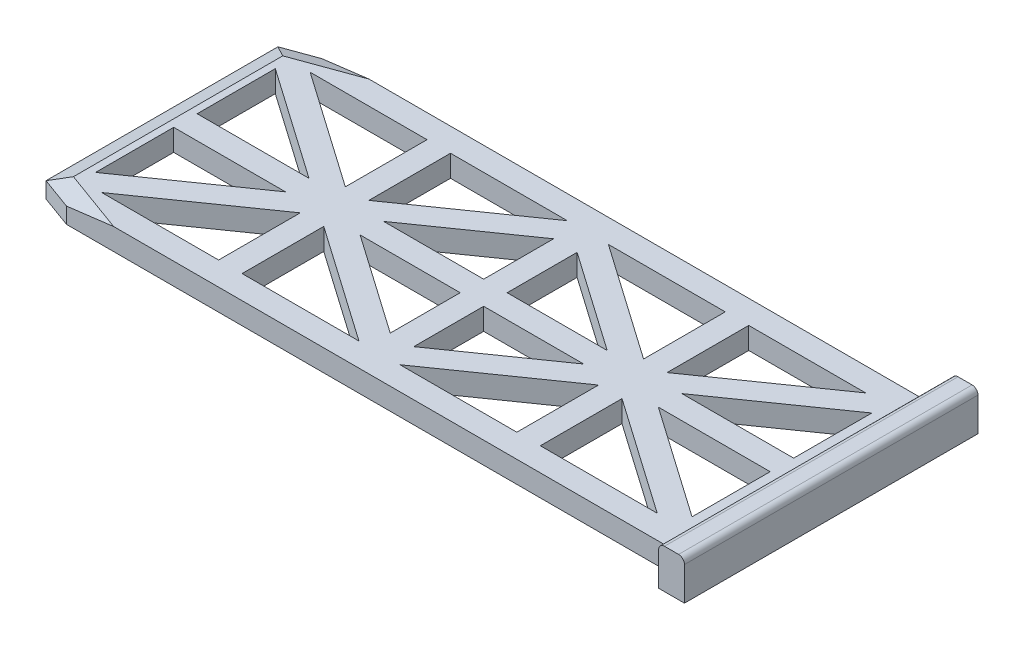
from build123d import *
from OCP.BRepFilletAPI import BRepFilletAPI_MakeChamfer

# Parameters (mm, degrees)
SKETCH1_W                = 114
SKETCH1_H                = 43.5
BOSS_EXTRUDE1_DEPTH      = 3.7
SKETCH2_W                = 4.4
SKETCH2_H                = 43.5
BOSS_EXTRUDE2_DEPTH      = 3
CHAMFER1_SIZE            = 2
CHAMFER1_SIZE2           = 5.494954839
CUT_EXTRUDE1_DEPTH       = 7.5
BOSS_EXTRUDE3_DEPTH      = 3.25
BOSS_EXTRUDE3_DEPTH_BACK = 46.75
SKETCH6_W                = 4.4
SKETCH6_H                = 6.7
FILLET2_R                = 1
CHAMFER2_SIZE            = 1
CHAMFER2_SIZE2           = 2.747477419


with BuildPart() as part:
    # Sketch1 → Boss-Extrude1 (new body)
    with BuildSketch(Plane(origin=(0, 0, 0), x_dir=(1, 0, 0), z_dir=(0, 1, 0))):
        with Locations((57, 21.75)):
            Rectangle(SKETCH1_W, SKETCH1_H)
    extrude(amount=BOSS_EXTRUDE1_DEPTH)

    # Sketch2 → Boss-Extrude2 (add)
    with BuildSketch(Plane(origin=(0, 3.7, 0), x_dir=(1, 0, 0), z_dir=(0, 1, 0))):
        with Locations((111.8, 21.75)):
            Rectangle(SKETCH2_W, SKETCH2_H)
    extrude(amount=BOSS_EXTRUDE2_DEPTH)

    # Chamfer1
    chamfer1_edges = [part.edges().sort_by_distance(p)[0] for p in [
        (0, 1.85, -43.5),
        (0, 1.85, 0),
    ]]
    chamfer1_side = [part.faces().sort_by_distance(p)[0] for p in [
        (0, 1.85, -21.75),
    ]]
    chamfer(chamfer1_edges, length=CHAMFER1_SIZE, length2=CHAMFER1_SIZE2, reference=chamfer1_side[0])

    # Sketch3 → Cut-Extrude1 (cut)
    with BuildSketch(Plane(origin=(0, 3.7, 0), x_dir=(1, 0, 0), z_dir=(0, 1, 0))):
        Polygon((4, 6.439957255), (23.046483703, 19.75), (4, 19.75), align=None)
        Polygon((27.4, 4), (27.4, 17.91240495), (7.491544466, 4), align=None)
        Polygon((23.046483703, 23.75), (4, 37.060042745), (4, 23.75), align=None)
        Polygon((27.4, 25.58759505), (27.4, 39.5), (7.491544466, 39.5), align=None)
        Polygon((31.4, 25.58759505), (51.308455534, 39.5), (31.4, 39.5), align=None)
        Polygon((52.8, 23.75), (52.8, 35.66240495), (35.753516297, 23.75), align=None)
        Polygon((52.8, 7.83759505), (52.8, 19.75), (35.753516297, 19.75), align=None)
        Polygon((31.4, 4), (51.308455534, 4), (31.4, 17.91240495), align=None)
        Polygon((73.846483703, 19.75), (56.8, 19.75), (56.8, 7.83759505), align=None)
        Polygon((78.2, 17.91240495), (58.291544466, 4), (78.2, 4), align=None)
        Polygon((56.8, 35.66240495), (56.8, 23.75), (73.846483703, 23.75), align=None)
        Polygon((78.2, 39.5), (58.291544466, 39.5), (78.2, 25.58759505), align=None)
        Polygon((102.108455534, 39.5), (82.2, 39.5), (82.2, 25.58759505), align=None)
        Polygon((105.6, 23.75), (105.6, 37.060042745), (86.553516297, 23.75), align=None)
        Polygon((105.6, 19.75), (86.553516297, 19.75), (105.6, 6.439957255), align=None)
        Polygon((82.2, 17.91240495), (82.2, 4), (102.108455534, 4), align=None)
    extrude(amount=-CUT_EXTRUDE1_DEPTH, mode=Mode.SUBTRACT)

    # Sketch6 → Boss-Extrude3 (add, two sides: drawn at the far end of the back side and taken through both)
    with BuildSketch(Plane.XY.offset(-BOSS_EXTRUDE3_DEPTH_BACK)):
        with Locations((111.8, 3.35)):
            Rectangle(SKETCH6_W, SKETCH6_H)
    extrude(amount=BOSS_EXTRUDE3_DEPTH + BOSS_EXTRUDE3_DEPTH_BACK)

    # Fillet2
    fillet2_edges = [part.edges().sort_by_distance(p)[0] for p in [
        (114, 6.7, -21.75),
        (109.6, 6.7, -21.75),
    ]]
    fillet(fillet2_edges, radius=FILLET2_R)

    # Chamfer2: one chamfer whose edges measure the first distance from different faces: ONE call of the kernel's chamfer builder (chamfer() names one face for all edges)
    chamfer2_edges_1 = [part.edges().sort_by_distance(p)[0] for p in [
        (0, 3.7, -21.75),
    ]]
    chamfer2_side_1 = [part.faces().sort_by_distance(p)[0] for p in [
        (0, 1.85, -21.75),
    ]]
    chamfer2_edges_2 = [part.edges().sort_by_distance(p)[0] for p in [
        (2.747477419, 3.7, -1),
    ]]
    chamfer2_side_2 = [part.faces().sort_by_distance(p)[0] for p in [
        (2.747477419, 1.85, -1),
    ]]
    chamfer2_edges_3 = [part.edges().sort_by_distance(p)[0] for p in [
        (2.747477419, 3.7, -42.5),
    ]]
    chamfer2_side_3 = [part.faces().sort_by_distance(p)[0] for p in [
        (2.747477419, 1.85, -42.5),
    ]]
    chamfer2 = BRepFilletAPI_MakeChamfer(part.part.solid().wrapped)
    for e in chamfer2_edges_1:
        chamfer2.Add(CHAMFER2_SIZE, CHAMFER2_SIZE2, e.wrapped, chamfer2_side_1[0].wrapped)  # the first distance lies on this face
    for e in chamfer2_edges_2:
        chamfer2.Add(CHAMFER2_SIZE, CHAMFER2_SIZE2, e.wrapped, chamfer2_side_2[0].wrapped)  # the first distance lies on this face
    for e in chamfer2_edges_3:
        chamfer2.Add(CHAMFER2_SIZE, CHAMFER2_SIZE2, e.wrapped, chamfer2_side_3[0].wrapped)  # the first distance lies on this face
    add(Compound.cast(chamfer2.Shape()), mode=Mode.REPLACE)


solid = part.part
